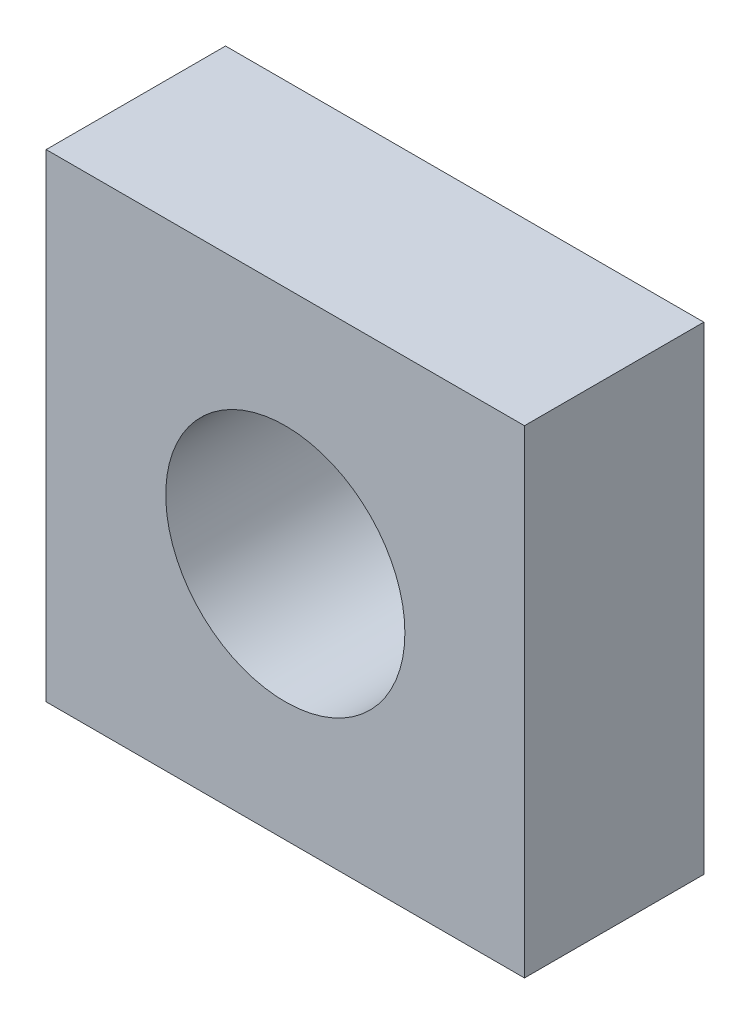
from build123d import *

# Parameters (mm, degrees)
CROQUIS1_W              = 80
CROQUIS1_H              = 80
CROQUIS1_R              = 20
SALIENTE_EXTRUIR2_DEPTH = 30


with BuildPart() as part:
    # Croquis1 → Saliente-Extruir2 (new body)
    with BuildSketch(Plane.XY):
        with Locations((610, 540)):
            Rectangle(CROQUIS1_W, CROQUIS1_H)
        with Locations((610, 540)):
            Circle(CROQUIS1_R, mode=Mode.SUBTRACT)
    extrude(amount=SALIENTE_EXTRUIR2_DEPTH)


solid = part.part
